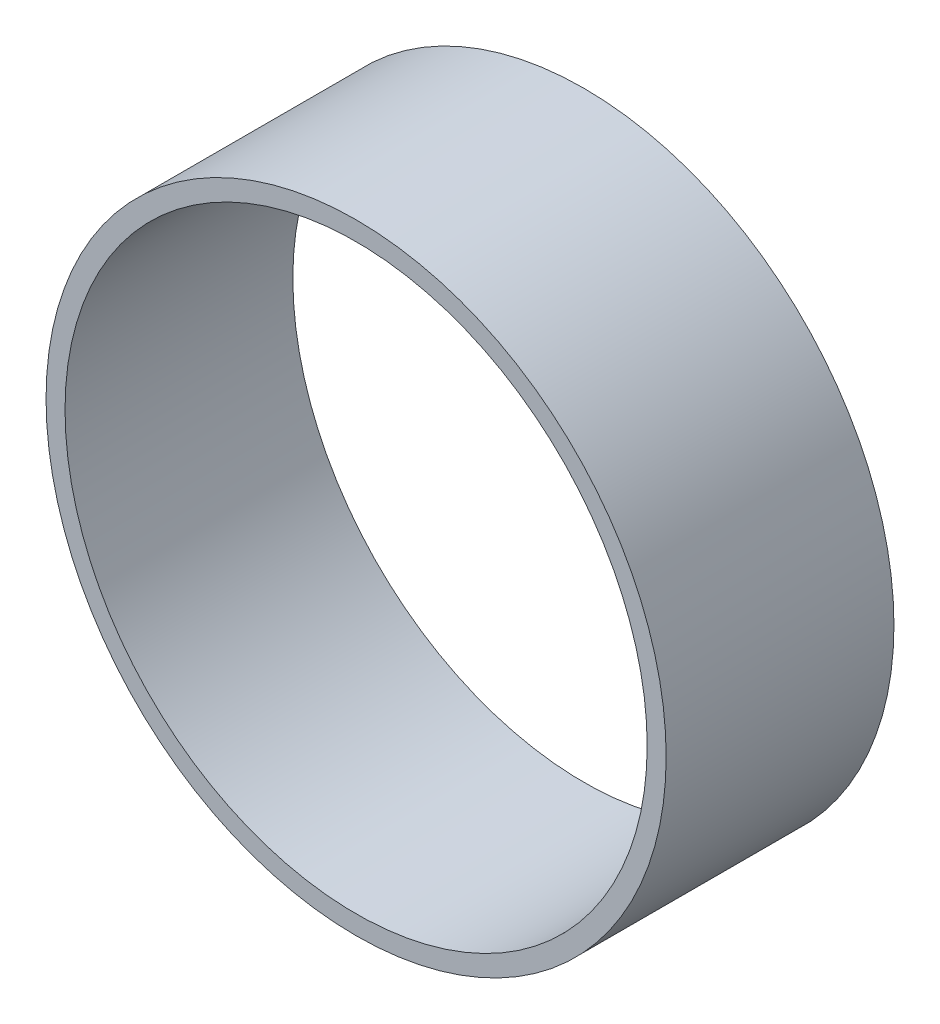
from build123d import *

# Parameters (mm, degrees)
SKETCH1_R           = 122.5
SKETCH1_R_2         = 115
BOSS_EXTRUDE1_DEPTH = 90


with BuildPart() as part:
    # Sketch1 → Boss-Extrude1 (new body)
    with BuildSketch(Plane.XY):
        with Locations(Location((0, 0, 0), (0, 0, 180))):
            Circle(SKETCH1_R)
        with Locations(Location((0, 0, 0), (0, 0, 180))):
            Circle(SKETCH1_R_2, mode=Mode.SUBTRACT)
    extrude(amount=BOSS_EXTRUDE1_DEPTH)


solid = part.part
